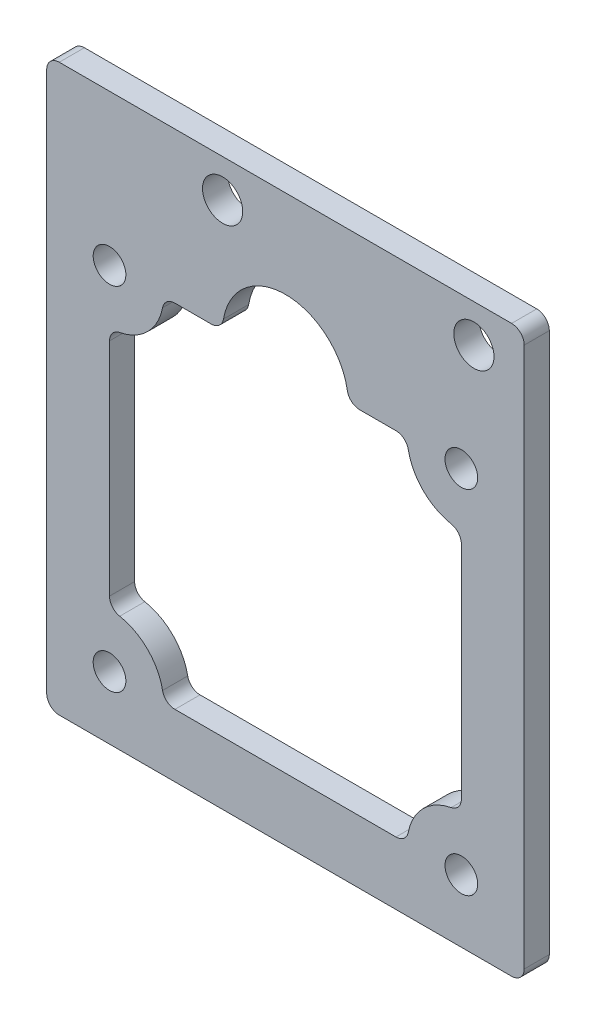
from build123d import *

# Parameters (mm, degrees)
SKETCH_1_W          = 38
SKETCH_1_H          = 38
SKETCH_1_R          = 1.3
EXTRUDE_1_DEPTH     = 2
SKETCH_2_W          = 38
SKETCH_2_H          = 7
SKETCH_2_R          = 1.6
EXTRUDE_2_DEPTH     = 2
SKETCH_3_R          = 5
CUT_EXTRUDE_1_DEPTH = 33.26453161
FILLET_1_R          = 1


with BuildPart() as part:
    # 草图1 → 凸台-拉伸1 (new body)
    with BuildSketch(Plane.XY):
        Rectangle(SKETCH_1_W, SKETCH_1_H)
        with BuildLine():
            Line((-14, -9.7), (-14, 9.7))
            ThreePointArc((-14, 9.7), (-10.959440841, 10.959440841), (-9.7, 14))
            Line((-9.7, 14), (9.7, 14))
            ThreePointArc((9.7, 14), (10.959440841, 10.959440841), (14, 9.7))
            Line((14, 9.7), (14, -9.7))
            ThreePointArc((14, -9.7), (10.959440841, -10.959440841), (9.7, -14))
            Line((9.7, -14), (-9.7, -14))
            ThreePointArc((-9.7, -14), (-10.959440841, -10.959440841), (-14, -9.7))
        make_face(mode=Mode.SUBTRACT)
        with Locations((14, -14)):
            Circle(SKETCH_1_R, mode=Mode.SUBTRACT)
        with Locations((14, 14)):
            Circle(SKETCH_1_R, mode=Mode.SUBTRACT)
        with Locations((-14, 14)):
            Circle(SKETCH_1_R, mode=Mode.SUBTRACT)
        with Locations((-14, -14)):
            Circle(SKETCH_1_R, mode=Mode.SUBTRACT)
    extrude(amount=EXTRUDE_1_DEPTH)

    # 草图2 → 凸台-拉伸2 (add)
    with BuildSketch(Plane.XY.offset(2)):
        with Locations((0, 22.5)):
            Rectangle(SKETCH_2_W, SKETCH_2_H)
        with Locations((-5, 23)):
            Circle(SKETCH_2_R, mode=Mode.SUBTRACT)
        with Locations((15, 23)):
            Circle(SKETCH_2_R, mode=Mode.SUBTRACT)
    extrude(amount=-EXTRUDE_2_DEPTH)

    # 草图3 → 切除-拉伸1 (cut, through all)
    with BuildSketch(Plane.XY.offset(2)):
        with Locations((0, 14)):
            Circle(SKETCH_3_R)
    extrude(amount=-CUT_EXTRUDE_1_DEPTH, mode=Mode.SUBTRACT)

    # 圆角1
    fillet_1_edges = [part.edges().sort_by_distance(p)[0] for p in [
        (19, -19, 1),
        (-19, -19, 1),
        (-14, 9.7, 1),
        (-14, -9.7, 1),
        (-9.7, -14, 1),
        (9.7, -14, 1),
        (14, -9.7, 1),
        (14, 9.7, 1),
        (9.7, 14, 1),
        (-9.7, 14, 1),
        (19, 26, 1),
        (-19, 26, 1),
        (-5, 14, 1),
        (5, 14, 1),
    ]]
    fillet(fillet_1_edges, radius=FILLET_1_R)


solid = part.part
